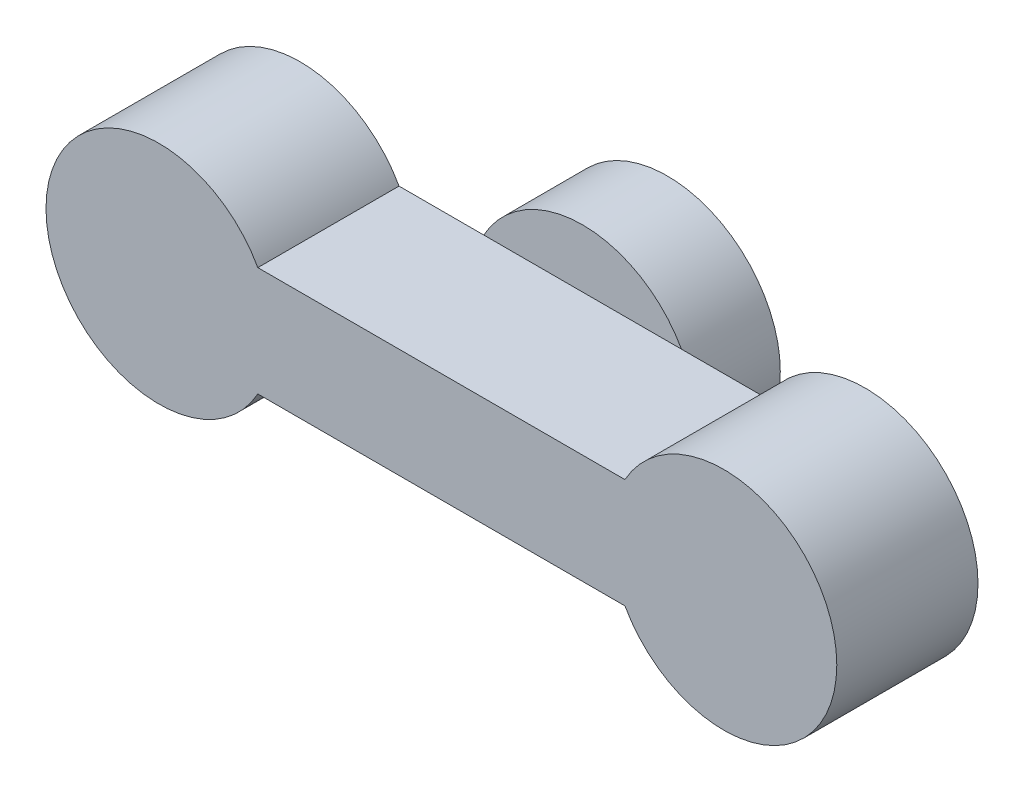
from build123d import *

# Parameters (mm, degrees)
SKETCH1_R           = 2
SKETCH1_R_2         = 1
BOSS_EXTRUDE1_DEPTH = 1
SKETCH2_R           = 2
BOSS_EXTRUDE2_DEPTH = 0.5
BOSS_EXTRUDE3_DEPTH = 2.5


with BuildPart() as part:
    # Sketch1 → Boss-Extrude1 (new body)
    with BuildSketch(Plane.XY):
        Circle(SKETCH1_R)
        Circle(SKETCH1_R_2, mode=Mode.SUBTRACT)
    extrude(amount=BOSS_EXTRUDE1_DEPTH)

    # Sketch2 → Boss-Extrude2 (add)
    with BuildSketch(Plane.XY.offset(1)):
        Circle(SKETCH2_R)
    extrude(amount=BOSS_EXTRUDE2_DEPTH)

    # Sketch3 → Boss-Extrude3 (add)
    with BuildSketch(Plane.XY.offset(1.5)):
        with BuildLine():
            Line((3.25, -0.968245837), (-3.25, -0.968245837))
            ThreePointArc((-3.25, -0.968245837), (-7, 0), (-3.25, 0.968245837))
            Line((-3.25, 0.968245837), (3.25, 0.968245837))
            ThreePointArc((3.25, 0.968245837), (7, 0), (3.25, -0.968245837))
        make_face()
    extrude(amount=BOSS_EXTRUDE3_DEPTH)


solid = part.part
